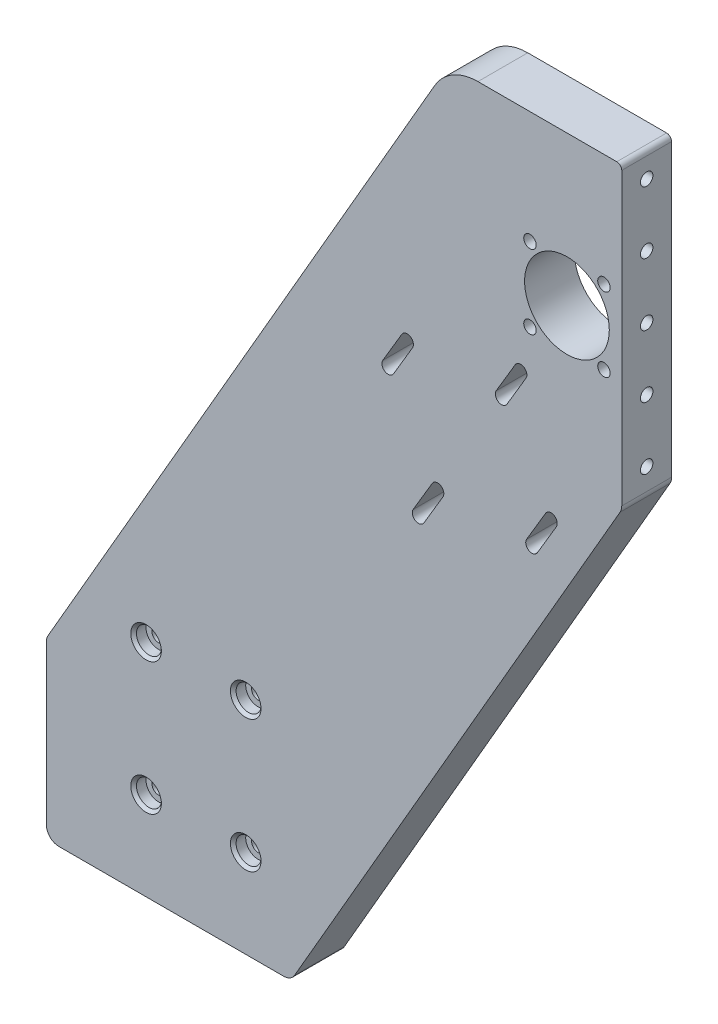
from build123d import *

# Parameters (mm, degrees)
SCHIZZO1_R                    = 17
SCHIZZO1_R_2                  = 2.5
ESTRUSIONE_ESTRUSIONE2_DEPTH  = 20
M5_TAPPED_HOLE1_D             = 4.2
M5_TAPPED_HOLE1_DEPTH         = 17.4
M5_TAPPED_HOLE1_TIP           = 1.2618073
CBORE_FOR_M5_SHCS1_AT_2_COUNT = 2
CBORE_FOR_M5_SHCS1_AT_2_PITCH = 53
CBORE_FOR_M5_SHCS1_AT_3_COUNT = 2
CBORE_FOR_M5_SHCS1_AT_3_PITCH = 66.400301204
CBORE_FOR_M5_SHCS1_AT_4_COUNT = 2
CBORE_FOR_M5_SHCS1_AT_4_PITCH = 40
M6_TAPPED_HOLE1_D             = 5
M6_TAPPED_HOLE1_DEPTH         = 19
M6_TAPPED_HOLE1_TIP           = 1.502151548
CUT_EXTRUDE1_DEPTH            = 420.801540473


with BuildPart() as part:
    # Schizzo1 → Estrusione-Estrusione2 (new body)
    with BuildSketch(Plane.XY):
        with BuildLine():
            Line((5, 0), (95.262794416, 0))
            ThreePointArc((95.262794416, 0), (97.762794416, 0.669872981), (99.592921435, 2.5))
            Line((99.592921435, 2.5), (230.270234695, 228.839745962))
            ThreePointArc((230.270234695, 228.839745962), (230.769736807, 230.045650737), (230.940107676, 231.339745962))
            Line((230.940107676, 231.339745962), (230.940107676, 348))
            ThreePointArc((230.940107676, 348), (230.354321238, 349.414213562), (228.940107676, 350))
            Line((228.940107676, 350), (173.205080757, 350))
            ThreePointArc((173.205080757, 350), (163.205080757, 347.320508076), (155.884572681, 340))
            Line((155.884572681, 340), (0.669872981, 71.160254038))
            ThreePointArc((0.669872981, 71.160254038), (0.170370869, 69.954349263), (0, 68.660254038))
            Line((0, 68.660254038), (0, 5))
            ThreePointArc((0, 5), (1.464466094, 1.464466094), (5, 0))
        make_face()
        with Locations((208.940107676, 290)):
            Circle(SCHIZZO1_R, mode=Mode.SUBTRACT)
        with Locations((223.789350081, 304.849242405)):
            Circle(SCHIZZO1_R_2, mode=Mode.SUBTRACT)
        with Locations((223.789350081, 275.150757595)):
            Circle(SCHIZZO1_R_2, mode=Mode.SUBTRACT)
        with Locations((194.090865271, 275.150757595)):
            Circle(SCHIZZO1_R_2, mode=Mode.SUBTRACT)
        with Locations((194.090865271, 304.849242405)):
            Circle(SCHIZZO1_R_2, mode=Mode.SUBTRACT)
    extrude(amount=-ESTRUSIONE_ESTRUSIONE2_DEPTH)

    # M5 Tapped Hole1
    with Locations(Plane(origin=(50.131397208, 0, -10), x_dir=(0, 0, -1), z_dir=(0, -1, 0))):
        with Locations((0, 0), (0, 35), (0, -35)):
            Hole(M5_TAPPED_HOLE1_D / 2, depth=M5_TAPPED_HOLE1_DEPTH)
            with Locations((0, 0, -(M5_TAPPED_HOLE1_DEPTH + M5_TAPPED_HOLE1_TIP / 2))):  # 118° drill point
                Cone(0, M5_TAPPED_HOLE1_D / 2, M5_TAPPED_HOLE1_TIP, mode=Mode.SUBTRACT)

    # Sketch5 → CBORE for M5 SHCS1 (revolve, cut)
    with BuildSketch(Plane(origin=(80, 88.5, 0), x_dir=(0, -1, 0), z_dir=(1, 0, 0))):
        Polygon((0, 0), (0, 20), (2.65, 20), (2.65, 5), (5, 5), (5, 1.145), (6.145, 0), align=None)
    cbore_for_m5_shcs1 = revolve(axis=Axis((80, 88.5, 6.35), (0, 0, -1)), mode=Mode.SUBTRACT)

    # CBORE for M5 SHCS1 at 2: CBORE for M5 SHCS1 ×2
    with Locations(*[(0, -i * CBORE_FOR_M5_SHCS1_AT_2_PITCH, 0) for i in range(1, CBORE_FOR_M5_SHCS1_AT_2_COUNT)]):
        add(cbore_for_m5_shcs1, mode=Mode.SUBTRACT)

    # CBORE for M5 SHCS1 at 3: CBORE for M5 SHCS1 ×2
    with Locations(*[Vector(-0.6024069059118463, -0.7981891503332503, 0) * (i * CBORE_FOR_M5_SHCS1_AT_3_PITCH) for i in range(1, CBORE_FOR_M5_SHCS1_AT_3_COUNT)]):
        add(cbore_for_m5_shcs1, mode=Mode.SUBTRACT)

    # CBORE for M5 SHCS1 at 4: CBORE for M5 SHCS1 ×2
    with Locations(*[(-i * CBORE_FOR_M5_SHCS1_AT_4_PITCH, 0, 0) for i in range(1, CBORE_FOR_M5_SHCS1_AT_4_COUNT)]):
        add(cbore_for_m5_shcs1, mode=Mode.SUBTRACT)

    # M6 Tapped Hole1
    with Locations(Plane(origin=(230.940107676, 340, -10), x_dir=(0, 0, 1), z_dir=(1, 0, 0))):
        with Locations((0, 0), (0, 25), (0, 50), (0, 75), (0, 100)):
            Hole(M6_TAPPED_HOLE1_D / 2, depth=M6_TAPPED_HOLE1_DEPTH)
            with Locations((0, 0, -(M6_TAPPED_HOLE1_DEPTH + M6_TAPPED_HOLE1_TIP / 2))):  # 118° drill point
                Cone(0, M6_TAPPED_HOLE1_D / 2, M6_TAPPED_HOLE1_TIP, mode=Mode.SUBTRACT)

    # Sketch19 → Cut-Extrude1 (cut, through all)
    with BuildSketch(Plane.XY):
        with BuildLine():
            Line((180.542189015, 246.193907945), (188.198701931, 259.092660209))
            ThreePointArc((188.198701931, 259.092660209), (191.624579461, 259.966366767), (192.498286019, 256.540489237))
            Line((192.498286019, 256.540489237), (184.841773104, 243.641736973))
            ThreePointArc((184.841773104, 243.641736973), (181.415895574, 242.768030415), (180.542189015, 246.193907945))
        make_face()
        with BuildLine():
            Line((192.742918802, 200.660164494), (200.399431717, 213.558916758))
            ThreePointArc((200.399431717, 213.558916758), (203.825309247, 214.432623316), (204.699015805, 211.006745786))
            Line((204.699015805, 211.006745786), (197.04250289, 198.107993522))
            ThreePointArc((197.04250289, 198.107993522), (193.61662536, 197.234286964), (192.742918802, 200.660164494))
        make_face()
        with BuildLine():
            Line((147.20917535, 188.259881903), (154.865688266, 201.158634167))
            ThreePointArc((154.865688266, 201.158634167), (158.291565796, 202.032340725), (159.165272354, 198.606463195))
            Line((159.165272354, 198.606463195), (151.508759438, 185.707710931))
            ThreePointArc((151.508759438, 185.707710931), (148.082881908, 184.834004373), (147.20917535, 188.259881903))
        make_face()
        with BuildLine():
            Line((135.008445564, 233.993178159), (142.66495848, 246.891930423))
            ThreePointArc((142.66495848, 246.891930423), (146.09083601, 247.765636981), (146.964542568, 244.339759451))
            Line((146.964542568, 244.339759451), (139.308029652, 231.441007187))
            ThreePointArc((139.308029652, 231.441007187), (135.882152122, 230.567300629), (135.008445564, 233.993178159))
        make_face()
    extrude(amount=-CUT_EXTRUDE1_DEPTH, mode=Mode.SUBTRACT)


solid = part.part
